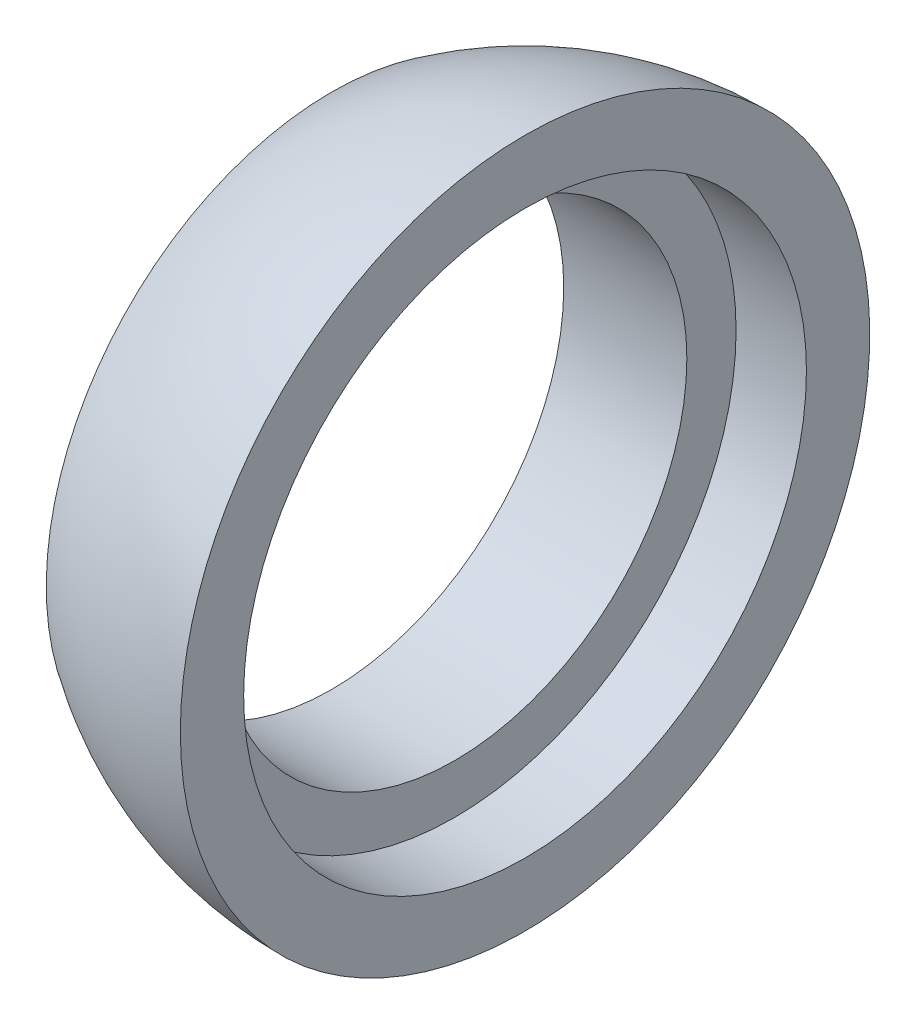
from build123d import *

# Parameters (mm, degrees)
REVOLVE_1_ANGLE          = 180
CUT_EXTRUDE_3_DEPTH      = 17.974097914
CUT_EXTRUDE_3_DEPTH_BACK = 17.974097914
SKETCH_5_W               = 4.939169432
SKETCH_5_H               = 18.941714771
SKETCH_11_R              = 6.6
CUT_EXTRUDE_7_DEPTH      = 15.910734388
SKETCH_12_R              = 8
CUT_EXTRUDE_8_DEPTH      = 2


with BuildPart() as part:
    # 草图1 → 旋转1 (revolve)
    with BuildSketch(Plane(origin=(0, 0, 0), x_dir=(0, 0, -1), z_dir=(1, 0, 0))):
        with BuildLine():
            Line((0, 9.8), (0, -9.8))
            ThreePointArc((0, -9.8), (-9.8, 0), (0, 9.8))
        make_face()
    revolve(axis=Axis((0, 9.8, 0), (0, -1, 0)), revolution_arc=REVOLVE_1_ANGLE)

    # 草图5 → 切除-拉伸3 (cut, two sides: drawn at the far end of the back side and taken through both)
    with BuildSketch(Plane.XY.offset(-CUT_EXTRUDE_3_DEPTH_BACK)):
        with Locations((-7.969584716, -0.432177325)):
            Rectangle(SKETCH_5_W, SKETCH_5_H)
    extrude(amount=CUT_EXTRUDE_3_DEPTH + CUT_EXTRUDE_3_DEPTH_BACK, mode=Mode.SUBTRACT)

    # 草图11 → 切除-拉伸7 (cut, through all)
    with BuildSketch(Plane(origin=(0, 0, 0), x_dir=(0, 0, -1), z_dir=(1, 0, 0))):
        Circle(SKETCH_11_R)
    extrude(amount=-CUT_EXTRUDE_7_DEPTH, mode=Mode.SUBTRACT)

    # 草图12 → 切除-拉伸8 (cut)
    with BuildSketch(Plane(origin=(0, 0, 0), x_dir=(0, 0, -1), z_dir=(1, 0, 0))):
        Circle(SKETCH_12_R)
    extrude(amount=-CUT_EXTRUDE_8_DEPTH, mode=Mode.SUBTRACT)


solid = part.part
